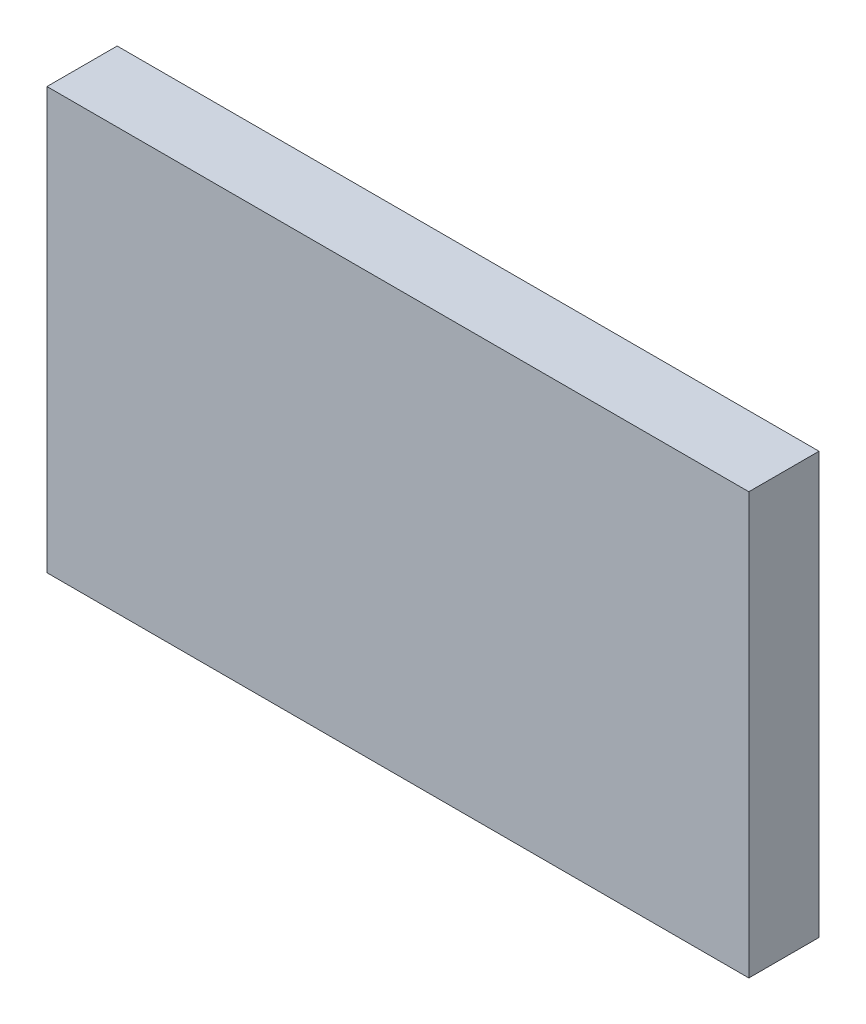
from build123d import *

# Parameters (mm, degrees)
SKETCH1_W           = 50
SKETCH1_H           = 30
BOSS_EXTRUDE1_DEPTH = 5


with BuildPart() as part:
    # Sketch1 → Boss-Extrude1 (new body)
    with BuildSketch(Plane.XY):
        Rectangle(SKETCH1_W, SKETCH1_H)
    extrude(amount=BOSS_EXTRUDE1_DEPTH)


solid = part.part
